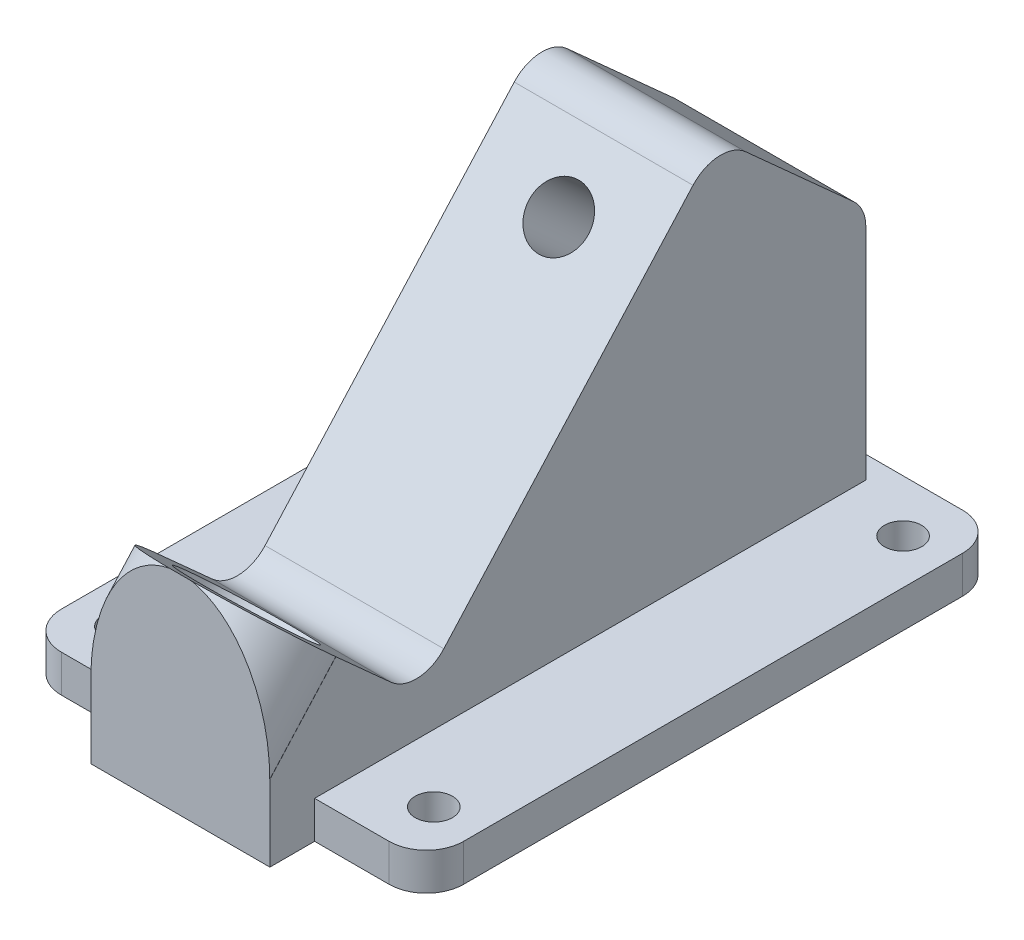
from build123d import *

# Parameters (mm, degrees)
SKETCH1_W                       = 54
SKETCH1_H                       = 77
BOSS_EXTRUDE1_DEPTH             = 5
SKETCH3_W                       = 24
SKETCH3_H                       = 80
BOSS_EXTRUDE2_DEPTH             = 60
BOSS_EXTRUDE2_DIRECTION_2_REACH = 49.289
CUT_EXTRUDE5_DEPTH              = 88.89908987
SKETCH9_R                       = 4
CUT_EXTRUDE7_DEPTH              = 74.599714303
FILLET4_R                       = 5
SKETCH10_R                      = 7.5
CUT_EXTRUDE8_DEPTH              = 20
F_5_0_5_DIAMETER_HOLE1_D        = 5
FILLET7_R                       = 5
CUT_EXTRUDE9_DEPTH              = 79.817150767


with BuildPart() as part:
    # Sketch1 → Boss-Extrude1 (new body)
    with BuildSketch(Plane(origin=(0, 0, 0), x_dir=(1, 0, 0), z_dir=(0, 1, 0))):
        Rectangle(SKETCH1_W, SKETCH1_H)
    extrude(amount=BOSS_EXTRUDE1_DEPTH)

    # Sketch3 → Boss-Extrude2 (add)
    with BuildSketch(Plane(origin=(0, 5, 0), x_dir=(1, 0, 0), z_dir=(0, 1, 0))):
        with Locations((0, -4.5)):
            Rectangle(SKETCH3_W, SKETCH3_H)
    extrude(amount=BOSS_EXTRUDE2_DEPTH)

    # Boss-Extrude2 direction 2: up to this face of the body (flat: up to its plane)
    boss_extrude2_direction_2_end = Plane(part.part.faces().sort_by_distance((0, 0, 0))[0])
    # Sketch3 → Boss-Extrude2 direction 2 (add, up to the picked face)
    with BuildSketch(Plane(origin=(0, 5, 0), x_dir=(1, 0, 0), z_dir=(0, 1, 0)), mode=Mode.PRIVATE) as boss_extrude2_direction_2_sk1:
        with Locations((0, -4.5)):
            Rectangle(SKETCH3_W, SKETCH3_H)
    boss_extrude2_direction_2_tool1 = split(extrude(boss_extrude2_direction_2_sk1.sketch, amount=-BOSS_EXTRUDE2_DIRECTION_2_REACH, mode=Mode.PRIVATE), bisect_by=boss_extrude2_direction_2_end, keep=Keep.BOTH, mode=Mode.PRIVATE)
    add(boss_extrude2_direction_2_tool1.solids().sort_by(Axis((0, 5, 4.5), (0, -1, 0)))[0])

    # Sketch7 → Cut-Extrude5 (cut, through all)
    with BuildSketch(Plane(origin=(12, 0, 0), x_dir=(0, 0, -1), z_dir=(1, 0, 0))):
        Polygon((-46.794344764, 30.073918191), (-24.5, 10), (15.647836382, 54.588689529), (50.5, 23.207660454), (50.5, 70), (-49.5, 70), (-49.5, 27.068983625), align=None)
    extrude(amount=-CUT_EXTRUDE5_DEPTH, mode=Mode.SUBTRACT)

    # Sketch9 → Cut-Extrude7 (cut, through all)
    with BuildSketch(Plane(origin=(0, 16.660250902, 18.503083152), x_dir=(1, 0, 0), z_dir=(0, 0.6691306063588566, 0.7431448254773958))):
        with Locations(Location((0, 37.037748399, 0), (0, 0, 270))):
            Circle(SKETCH9_R)
    extrude(amount=-CUT_EXTRUDE7_DEPTH, mode=Mode.SUBTRACT)

    # Fillet4
    fillet4_edges = [part.edges().sort_by_distance(p)[0] for p in [
        (0, 36.713721119, -35.5),
        (0, 54.588689529, -15.647836382),
        (0, 10, 24.5),
    ]]
    fillet(fillet4_edges, radius=FILLET4_R)

    # Sketch10 → Cut-Extrude8 (cut)
    with BuildSketch(Plane(origin=(0, -13.450626384, -14.938433995), x_dir=(1, 0, 0), z_dir=(0, 0.6691306063588566, 0.7431448254773958))):
        with Locations(Location((0, 37.037748399, 0), (0, 0, 237.266633069))):
            Circle(SKETCH10_R)
    extrude(amount=CUT_EXTRUDE8_DEPTH, mode=Mode.SUBTRACT)

    # Ø5.0 (5) Diameter Hole1 (through all)
    with Locations(Plane(origin=(21, 0, -31.5), x_dir=(0, 0, -1), z_dir=(0, -1, 0))):
        with Locations((0, 0), (0, -42), (-63, -42), (-63, 0)):
            Hole(F_5_0_5_DIAMETER_HOLE1_D / 2)

    # Fillet7
    fillet7_edges = [part.edges().sort_by_distance(p)[0] for p in [
        (27, 2.5, 38.5),
        (-27, 2.5, 38.5),
        (-27, 2.5, -38.5),
        (27, 2.5, -38.5),
    ]]
    fillet(fillet7_edges, radius=FILLET7_R)

    # Sketch8 → Cut-Revolve4 (revolve, cut)
    with BuildSketch(Plane(origin=(0, -6.660250902, 5.996916848), x_dir=(1, 0, 0), z_dir=(0, 0.7431448254773959, -0.6691306063588564))):
        with BuildLine():
            Line((0, -47.898354288), (0, -31.898354288))
            ThreePointArc((0, -31.898354288), (8, -39.898354288), (0, -47.898354288))
        make_face()
    revolve(axis=Axis((0, 28.008080886, 44.5), (0, -0.6691306063588564, -0.7431448254773959)), mode=Mode.SUBTRACT)

    # Sketch13 → Cut-Extrude9 (cut, through all)
    with BuildSketch(Plane(origin=(0, -6.660250902, 5.996916848), x_dir=(1, 0, 0), z_dir=(0, 0.7431448254773957, -0.6691306063588566))):
        with BuildLine():
            Line((-12.01867578, -39.898354288), (-15.599845955, -39.898354288))
            Line((-15.599845955, -39.898354288), (-15.599845955, -55.363727993))
            Line((-15.599845955, -55.363727993), (15.599845955, -55.363727993))
            Line((15.599845955, -55.363727993), (15.599845955, -39.898354288))
            Line((15.599845955, -39.898354288), (11.98132422, -39.898354288))
            ThreePointArc((11.98132422, -39.898354288), (-0.01867578, -51.898354288), (-12.01867578, -39.898354288))
        make_face()
    extrude(amount=-CUT_EXTRUDE9_DEPTH, mode=Mode.SUBTRACT)


solid = part.part
